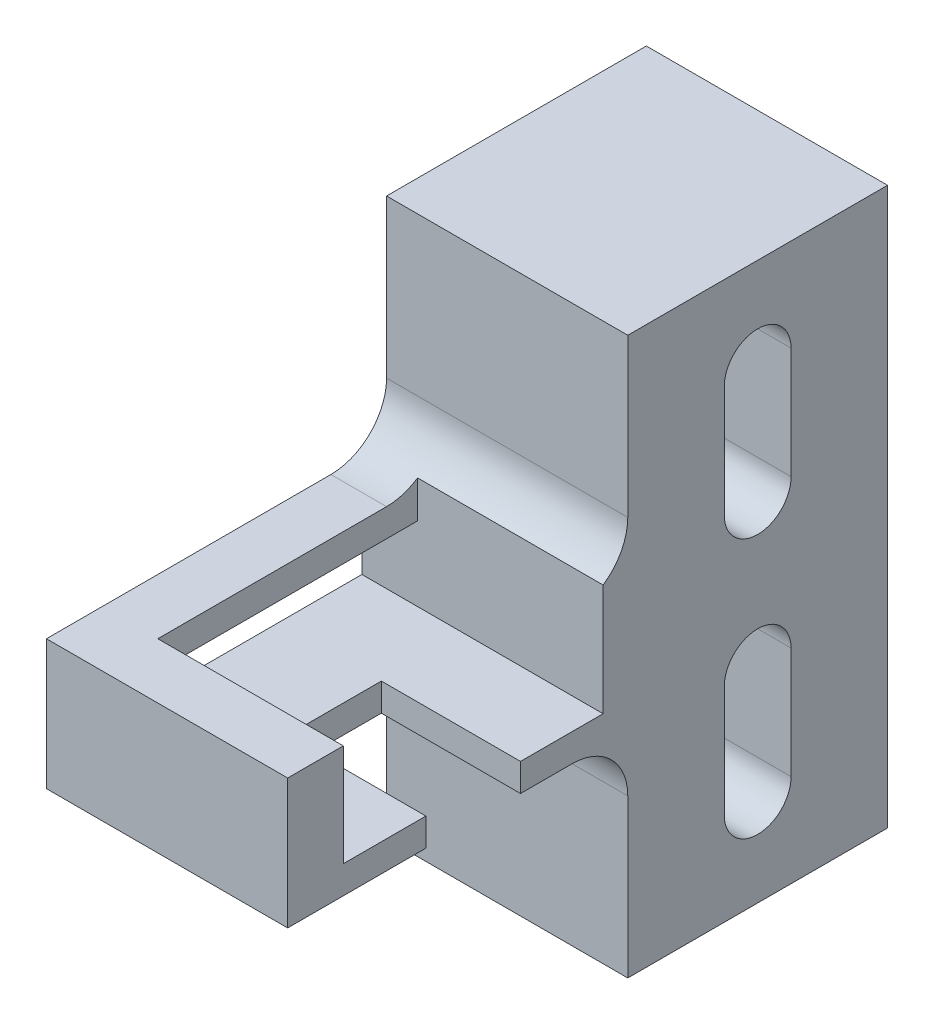
from build123d import *

# Parameters (mm, degrees)
SKETCH1_W           = 13
SKETCH1_H           = 30
BOSS_EXTRUDE1_DEPTH = 14
SKETCH2_W           = 13
SKETCH2_H           = 7
BOSS_EXTRUDE2_DEPTH = 18.33
SKETCH3_W           = 10
SKETCH3_H           = 14
CUT_EXTRUDE1_DEPTH  = 5.5
SKETCH4_W           = 14
SKETCH4_H           = 4
CUT_EXTRUDE2_DEPTH  = 46.224207014
FILLET1_R           = 3
CUT_EXTRUDE3_DEPTH  = 46.980744883
SKETCH6_W           = 7.5
SKETCH6_H           = 5.1
CUT_EXTRUDE4_DEPTH  = 39.771495973


with BuildPart() as part:
    # Sketch1 → Boss-Extrude1 (new body)
    with BuildSketch(Plane.XY):
        with Locations((6.5, 15)):
            Rectangle(SKETCH1_W, SKETCH1_H)
    extrude(amount=BOSS_EXTRUDE1_DEPTH)

    # Sketch2 → Boss-Extrude2 (add)
    with BuildSketch(Plane.XY.offset(14)):
        with Locations((6.5, 15)):
            Rectangle(SKETCH2_W, SKETCH2_H)
    extrude(amount=BOSS_EXTRUDE2_DEPTH)

    # Sketch3 → Cut-Extrude1 (cut)
    with BuildSketch(Plane(origin=(0, 18.5, 0), x_dir=(1, 0, 0), z_dir=(0, 1, 0))):
        with Locations((8, -22.33)):
            Rectangle(SKETCH3_W, SKETCH3_H)
    extrude(amount=-CUT_EXTRUDE1_DEPTH, mode=Mode.SUBTRACT)

    # Sketch4 → Cut-Extrude2 (cut, through all)
    with BuildSketch(Plane(origin=(3, 0, 0), x_dir=(0, 0, -1), z_dir=(1, 0, 0))):
        with Locations((-22.33, 15)):
            Rectangle(SKETCH4_W, SKETCH4_H)
    extrude(amount=-CUT_EXTRUDE2_DEPTH, mode=Mode.SUBTRACT)

    # Fillet1
    fillet1_edges = [part.edges().sort_by_distance(p)[0] for p in [
        (6.5, 11.5, 14),
        (6.5, 18.5, 14),
    ]]
    fillet(fillet1_edges, radius=FILLET1_R)

    # Sketch5 → Cut-Extrude3 (cut, through all)
    with BuildSketch(Plane.ZY):
        with BuildLine():
            Line((5.2, 5), (5.2, 11))
            ThreePointArc((5.2, 11), (7, 12.8), (8.8, 11))
            Line((8.8, 11), (8.8, 5))
            ThreePointArc((8.8, 5), (7, 3.2), (5.2, 5))
        make_face()
        with BuildLine():
            Line((5.2, 19), (5.2, 25))
            ThreePointArc((5.2, 25), (7, 26.8), (8.8, 25))
            Line((8.8, 25), (8.8, 19))
            ThreePointArc((8.8, 19), (7, 17.2), (5.2, 19))
        make_face()
    extrude(amount=-CUT_EXTRUDE3_DEPTH, mode=Mode.SUBTRACT)

    # Sketch6 → Cut-Extrude4 (cut, through all)
    with BuildSketch(Plane(origin=(0, 13, 0), x_dir=(1, 0, 0), z_dir=(0, 1, 0))):
        with Locations((9.25, -22.33)):
            Rectangle(SKETCH6_W, SKETCH6_H)
    extrude(amount=-CUT_EXTRUDE4_DEPTH, mode=Mode.SUBTRACT)


solid = part.part
